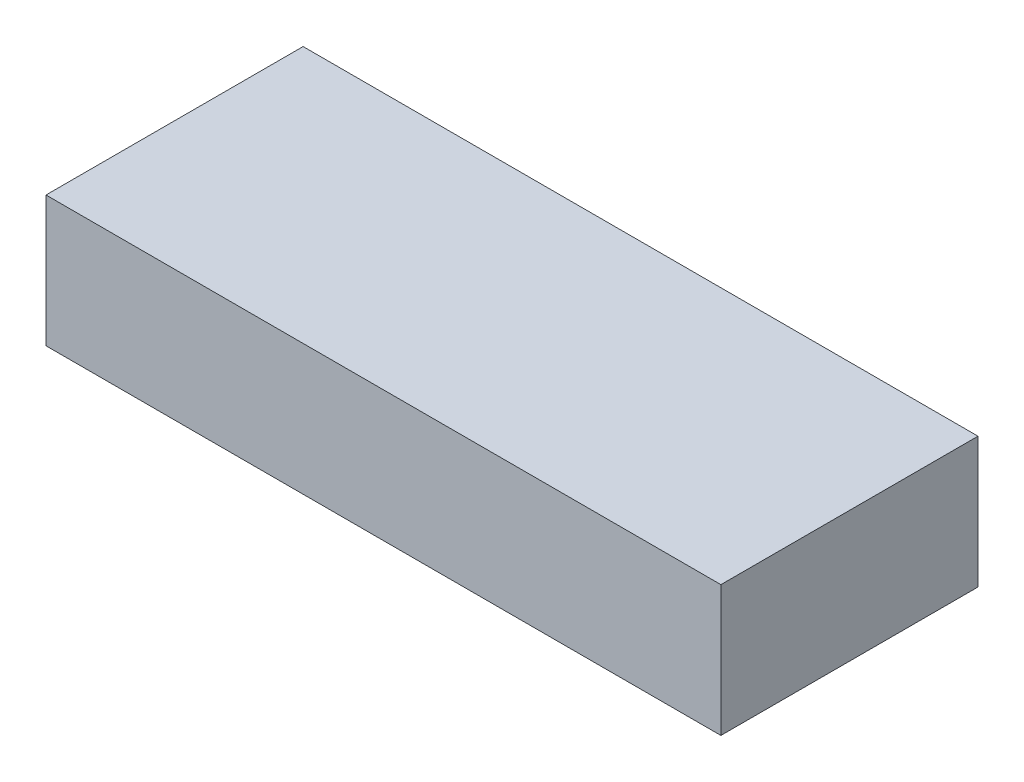
from build123d import *

# Parameters (mm, degrees)
SKETCH_1_W      = 31
SKETCH_1_H      = 6
EXTRUDE_1_DEPTH = 11.81


with BuildPart() as part:
    # 草圖1 → 填料-伸長1 (new body)
    with BuildSketch(Plane.XY):
        Rectangle(SKETCH_1_W, SKETCH_1_H)
    extrude(amount=EXTRUDE_1_DEPTH)


solid = part.part
